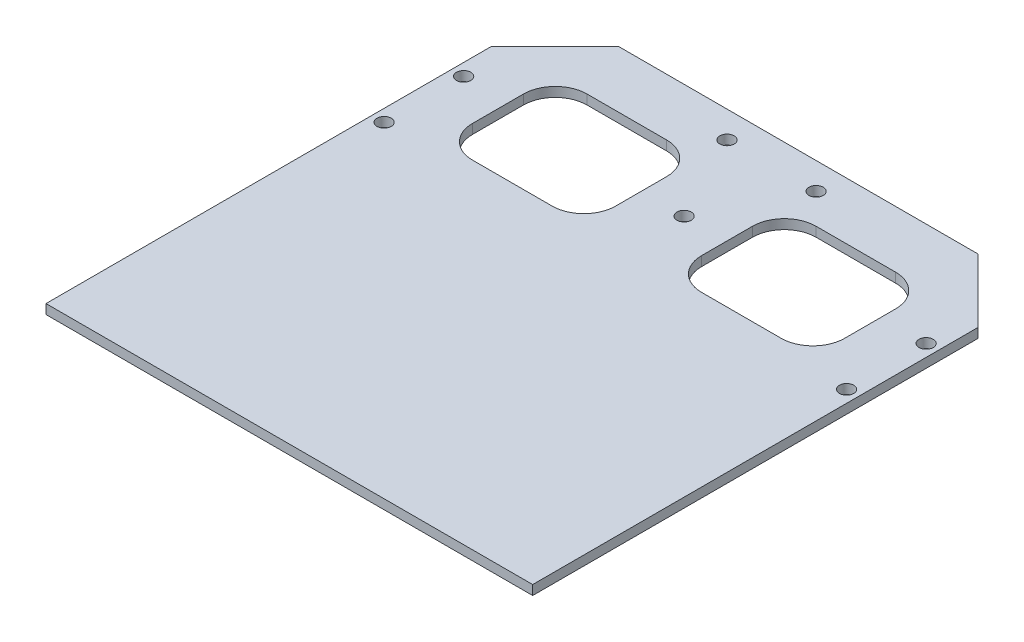
from build123d import *

# Parameters (mm, degrees)
SKETCH_1_W          = 153
SKETCH_1_H          = 160
EXTRUDE_1_DEPTH     = 3
SKETCH_2_R          = 2.25
CUT_EXTRUDE_1_DEPTH = 5
SKETCH_3_W          = 45
SKETCH_3_H          = 36
CUT_EXTRUDE_2_DEPTH = 5
FILLET_1_R          = 10
CHAMFER_1_SIZE      = 20


with BuildPart() as part:
    # 草图1 → 凸台-拉伸1 (new body)
    with BuildSketch(Plane(origin=(0, 0, 0), x_dir=(1, 0, 0), z_dir=(0, 1, 0))):
        Rectangle(SKETCH_1_W, SKETCH_1_H)
    extrude(amount=EXTRUDE_1_DEPTH)

    # 草图2 → 切除-拉伸1 (cut)
    with BuildSketch(Plane(origin=(0, 3, 0), x_dir=(1, 0, 0), z_dir=(0, 1, 0))):
        with Locations(Location((72.7, 47.5, 0), (0, 0, 270))):
            Circle(SKETCH_2_R)
        with Locations(Location((-72.7, 47.5, 0), (0, 0, 270))):
            Circle(SKETCH_2_R)
        with Locations(Location((72.7, 22.5, 0), (0, 0, 270))):
            Circle(SKETCH_2_R)
        with Locations(Location((-72.7, 22.5, 0), (0, 0, 270))):
            Circle(SKETCH_2_R)
        with Locations(Location((-14, 71.6, 0), (0, 0, 270))):
            Circle(SKETCH_2_R)
        with Locations(Location((14, 71.6, 0), (0, 0, 270))):
            Circle(SKETCH_2_R)
        with Locations(Location((0, 44.1, 0), (0, 0, 270))):
            Circle(SKETCH_2_R)
    extrude(amount=-CUT_EXTRUDE_1_DEPTH, mode=Mode.SUBTRACT)

    # 草图3 → 切除-拉伸2 (cut)
    with BuildSketch(Plane(origin=(0, 3, 0), x_dir=(1, 0, 0), z_dir=(0, 1, 0))):
        with Locations((36, 44.1)):
            Rectangle(SKETCH_3_W, SKETCH_3_H)
        with Locations((-36, 44.1)):
            Rectangle(SKETCH_3_W, SKETCH_3_H)
    extrude(amount=-CUT_EXTRUDE_2_DEPTH, mode=Mode.SUBTRACT)

    # 圆角1
    fillet_1_edges = [part.edges().sort_by_distance(p)[0] for p in [
        (58.5, 1.5, -62.1),
        (58.5, 1.5, -26.1),
        (13.5, 1.5, -26.1),
        (13.5, 1.5, -62.1),
        (-58.5, 1.5, -62.1),
        (-13.5, 1.5, -62.1),
        (-13.5, 1.5, -26.1),
        (-58.5, 1.5, -26.1),
    ]]
    fillet(fillet_1_edges, radius=FILLET_1_R)

    # 倒角1
    chamfer_1_edges = [part.edges().sort_by_distance(p)[0] for p in [
        (-76.5, 1.5, -80),
        (76.5, 1.5, -80),
    ]]
    chamfer(chamfer_1_edges, length=CHAMFER_1_SIZE)


solid = part.part
